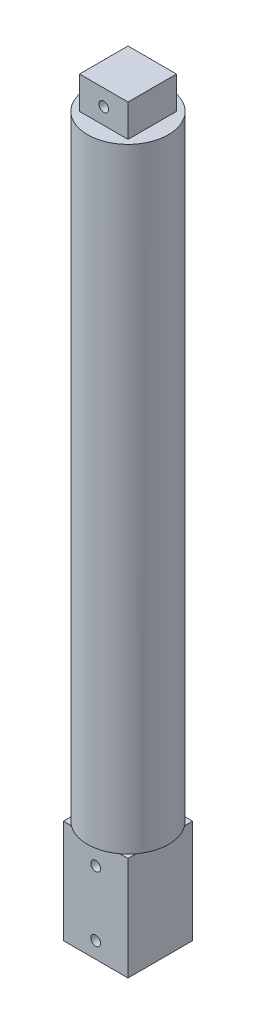
from build123d import *

# Parameters (mm, degrees)
SKETCH1_W           = 20
SKETCH1_H           = 32
SKETCH1_R           = 1.5
BOSS_EXTRUDE1_DEPTH = 10
SKETCH3_R           = 12.5
BOSS_EXTRUDE2_DEPTH = 200
SKETCH4_OUTSIDE_W   = 73.936
SKETCH4_OUTSIDE_H   = 73.936
SKETCH4_OUTSIDE_W_2 = 15
SKETCH4_OUTSIDE_H_2 = 15
CUT_EXTRUDE1_DEPTH  = 10
SKETCH5_R           = 1.5
CUT_EXTRUDE2_DEPTH  = 234.195733237


with BuildPart() as part:
    # Sketch1 → Boss-Extrude1 (new, symmetric)
    with BuildSketch(Plane.XY):
        with Locations((0, 16)):
            Rectangle(SKETCH1_W, SKETCH1_H)
        with Locations((0, 5)):
            Circle(SKETCH1_R, mode=Mode.SUBTRACT)
        with Locations((0, 25)):
            Circle(SKETCH1_R, mode=Mode.SUBTRACT)
    extrude(amount=BOSS_EXTRUDE1_DEPTH, both=True)

    # Sketch3 → Boss-Extrude2 (add)
    with BuildSketch(Plane(origin=(0, 32, 0), x_dir=(1, 0, 0), z_dir=(0, 1, 0))):
        with Locations(Location((0, 0, 0), (0, 0, 53.130102354))):
            Circle(SKETCH3_R)
    extrude(amount=BOSS_EXTRUDE2_DEPTH)

    # Sketch4 outside → Cut-Extrude1 (cut)
    with BuildSketch(Plane(origin=(0, 232, 0), x_dir=(1, 0, 0), z_dir=(0, 1, 0))):
        Rectangle(SKETCH4_OUTSIDE_W, SKETCH4_OUTSIDE_H)
        Rectangle(SKETCH4_OUTSIDE_W_2, SKETCH4_OUTSIDE_H_2, mode=Mode.SUBTRACT)
    extrude(amount=-CUT_EXTRUDE1_DEPTH, mode=Mode.SUBTRACT)

    # Sketch5 → Cut-Extrude2 (cut, through all)
    with BuildSketch(Plane.XY.offset(7.5)):
        with Locations((0, 227)):
            Circle(SKETCH5_R)
    extrude(amount=-CUT_EXTRUDE2_DEPTH, mode=Mode.SUBTRACT)


solid = part.part
